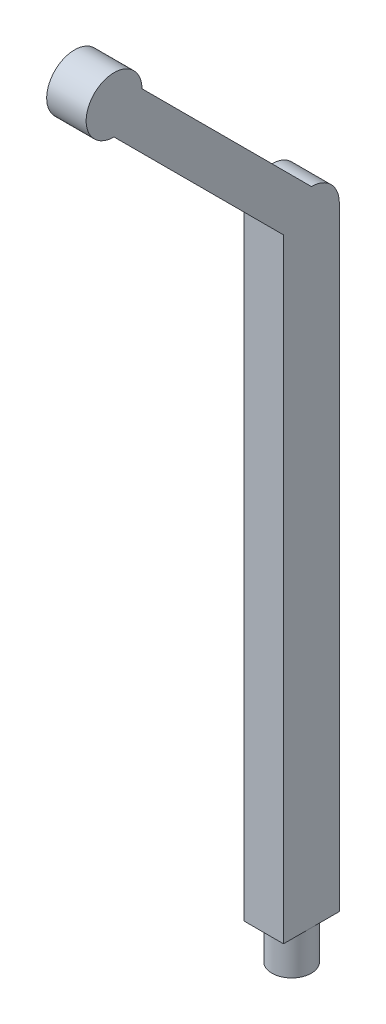
from build123d import *

# Parameters (mm, degrees)
EXTRUDE_2_DEPTH = 10
SKETCH_3_R      = 5
EXTRUDE_3_DEPTH = 10


with BuildPart() as part:
    # 草图1 → 凸台-拉伸2 (new body)
    with BuildSketch(Plane(origin=(0, 0, 0), x_dir=(0, 0, -1), z_dir=(1, 0, 0))):
        with BuildLine():
            Line((-7.071067812, 77.781745931), (-7.071067812, -77.781745931))
            Line((-7.071067812, -77.781745931), (7.071067812, -77.781745931))
            Line((7.071067812, -77.781745931), (7.071067812, 77.781745931))
            ThreePointArc((7.071067812, 77.781745931), (5, 82.781745931), (0, 84.852813742))
            Line((0, 84.852813742), (-42.928932188, 127.781745931))
            ThreePointArc((-42.928932188, 127.781745931), (-55, 132.781745931), (-50, 120.710678119))
            Line((-50, 120.710678119), (-7.071067812, 77.781745931))
        make_face()
    extrude(amount=EXTRUDE_2_DEPTH)

    # 草图3 → 凸台-拉伸3 (add)
    with BuildSketch(Plane.XZ.offset(77.781745931)):
        with Locations(Location((5, 0, 0), (0, 0, 180))):
            Circle(SKETCH_3_R)
    extrude(amount=EXTRUDE_3_DEPTH)


solid = part.part
